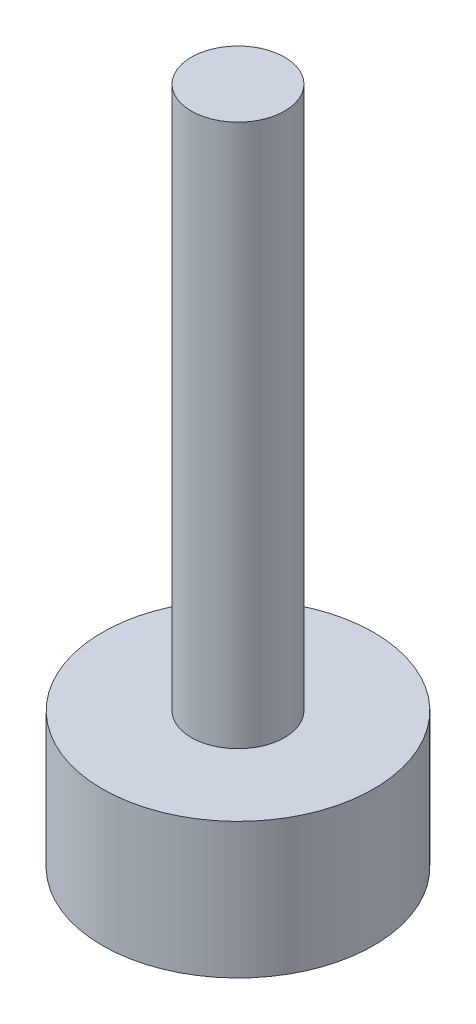
from build123d import *

# Parameters (mm, degrees)
SKETCH2_R           = 3.175
BOSS_EXTRUDE2_DEPTH = 3.175
SKETCH1_R           = 1.0922
BOSS_EXTRUDE3_DEPTH = 12.7


with BuildPart() as part:
    # Sketch2 → Boss-Extrude2 (new body)
    with BuildSketch(Plane(origin=(0, 0, 0), x_dir=(1, 0, 0), z_dir=(0, 1, 0))):
        with Locations(Location((0, 0, 0), (0, 0, 270))):
            Circle(SKETCH2_R)
    extrude(amount=-BOSS_EXTRUDE2_DEPTH)

    # Sketch1 → Boss-Extrude3 (add)
    with BuildSketch(Plane(origin=(0, 0, 0), x_dir=(1, 0, 0), z_dir=(0, 1, 0))):
        with Locations(Location((0, 0, 0), (0, 0, 270))):
            Circle(SKETCH1_R)
    extrude(amount=BOSS_EXTRUDE3_DEPTH)


solid = part.part
